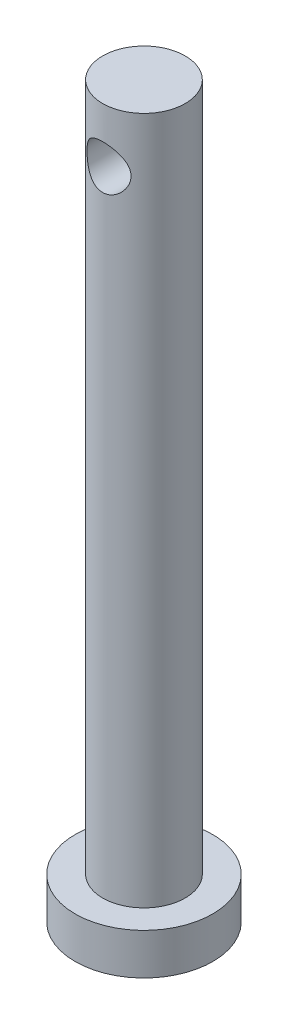
from build123d import *

# Parameters (mm, degrees)
SKETCH_1_R          = 2.5
EXTRUDE_1_DEPTH     = 1.5
SKETCH_2_R          = 1.5
EXTRUDE_2_DEPTH     = 25
SKETCH_3_R          = 0.8
CUT_EXTRUDE_1_DEPTH = 5


with BuildPart() as part:
    # 草图1 → 凸台-拉伸1 (new body)
    with BuildSketch(Plane(origin=(0, 0, 0), x_dir=(1, 0, 0), z_dir=(0, 1, 0))):
        with Locations(Location((0, 0, 0), (0, 0, 270))):
            Circle(SKETCH_1_R)
    extrude(amount=EXTRUDE_1_DEPTH)

    # 草图2 → 凸台-拉伸2 (add)
    with BuildSketch(Plane(origin=(0, 1.5, 0), x_dir=(1, 0, 0), z_dir=(0, 1, 0))):
        with Locations(Location((0, 0, 0), (0, 0, 270))):
            Circle(SKETCH_2_R)
    extrude(amount=EXTRUDE_2_DEPTH)

    # 草图3 → 切除-拉伸1 (cut, symmetric)
    with BuildSketch(Plane.XY):
        with Locations(Location((0, 24.5, 0), (0, 0, 89.999999995))):
            Circle(SKETCH_3_R)
    extrude(amount=CUT_EXTRUDE_1_DEPTH, both=True, mode=Mode.SUBTRACT)


solid = part.part
